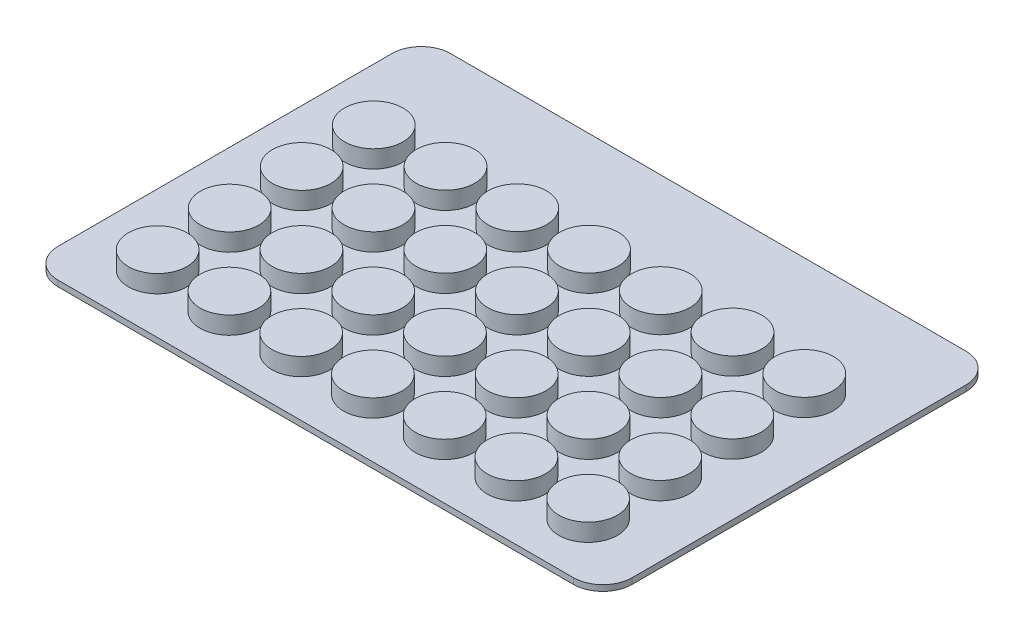
from build123d import *

# Parameters (mm, degrees)
BASE_DEPTH            = 1
SKETCH2_R             = 5
BLISTER_EXTRUDE_DEPTH = 3
BLISTER_PATTERN_COUNT = 4
BLISTER_PATTERN_PITCH = 12.3


with BuildPart() as part:
    # Sketch1 → Base (new body)
    with BuildSketch(Plane(origin=(0, 0, 0), x_dir=(1, 0, 0), z_dir=(0, 1, 0))):
        with BuildLine():
            Line((-44, -33.5), (44, -33.5))
            ThreePointArc((44, -33.5), (47.535533906, -32.035533906), (49, -28.5))
            Line((49, -28.5), (49, 28.5))
            ThreePointArc((49, 28.5), (47.535533906, 32.035533906), (44, 33.5))
            Line((44, 33.5), (-44, 33.5))
            ThreePointArc((-44, 33.5), (-47.535533906, 32.035533906), (-49, 28.5))
            Line((-49, 28.5), (-49, -28.5))
            ThreePointArc((-49, -28.5), (-47.535533906, -32.035533906), (-44, -33.5))
        make_face()
    extrude(amount=BASE_DEPTH)

    # Sketch2 → Blister-Extrude (add)
    with BuildSketch(Plane(origin=(0, 1, 0), x_dir=(1, 0, 0), z_dir=(0, 1, 0))):
        with Locations(Location((-37, -23.5, 0), (0, 0, 270))):
            Circle(SKETCH2_R)
        with Locations(Location((-24.75, -23.5, 0), (0, 0, 270))):
            Circle(SKETCH2_R)
        with Locations(Location((-12.5, -23.5, 0), (0, 0, 270))):
            Circle(SKETCH2_R)
        with Locations(Location((-0.25, -23.5, 0), (0, 0, 270))):
            Circle(SKETCH2_R)
        with Locations(Location((12, -23.5, 0), (0, 0, 270))):
            Circle(SKETCH2_R)
        with Locations(Location((24.25, -23.5, 0), (0, 0, 270))):
            Circle(SKETCH2_R)
        with Locations(Location((36.5, -23.5, 0), (0, 0, 270))):
            Circle(SKETCH2_R)
    blister_extrude = extrude(amount=BLISTER_EXTRUDE_DEPTH)

    # Blister-Pattern: Blister-Extrude ×4
    with Locations(*[(0, 0, -i * BLISTER_PATTERN_PITCH) for i in range(1, BLISTER_PATTERN_COUNT)]):
        add(blister_extrude)


solid = part.part
